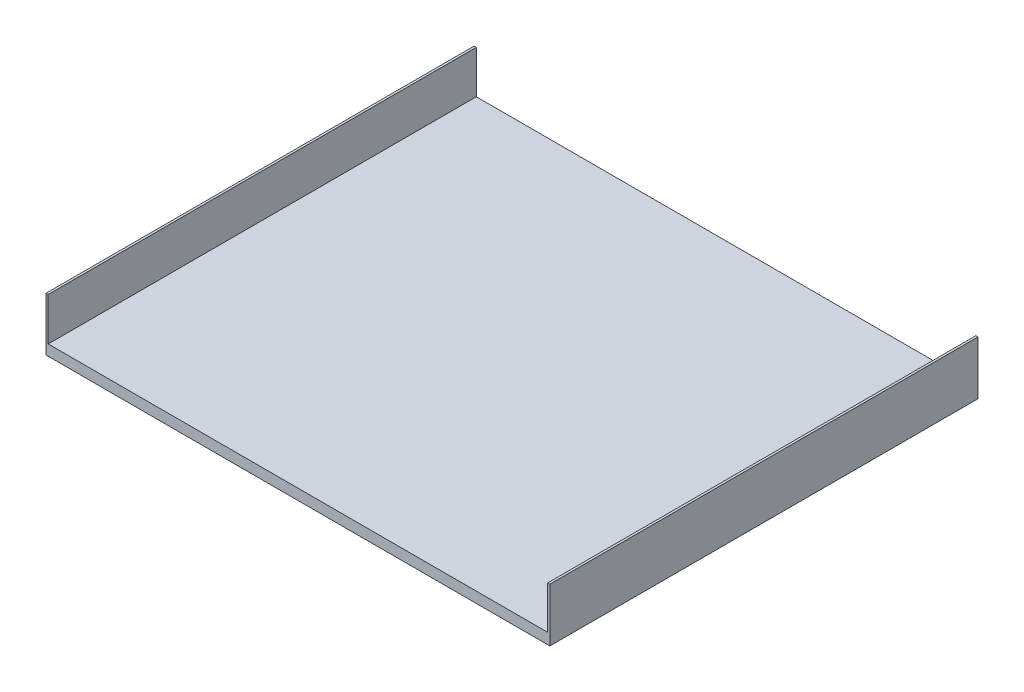
from build123d import *

# Parameters (mm, degrees)
SALIENTE_EXTRUIR1_DEPTH = 300


with BuildPart() as part:
    # Croquis1 → Saliente-Extruir1 (new, symmetric)
    with BuildSketch(Plane.XY):
        Polygon((0, -15), (0, 0), (-350, 0), (-350, 60), (-353.0625, 60), (-353.0625, -15), align=None)
        Polygon((350, 60), (350, 0), (0, 0), (0, -15), (353.0625, -15), (353.0625, 60), align=None)
    extrude(amount=SALIENTE_EXTRUIR1_DEPTH, both=True)


solid = part.part
